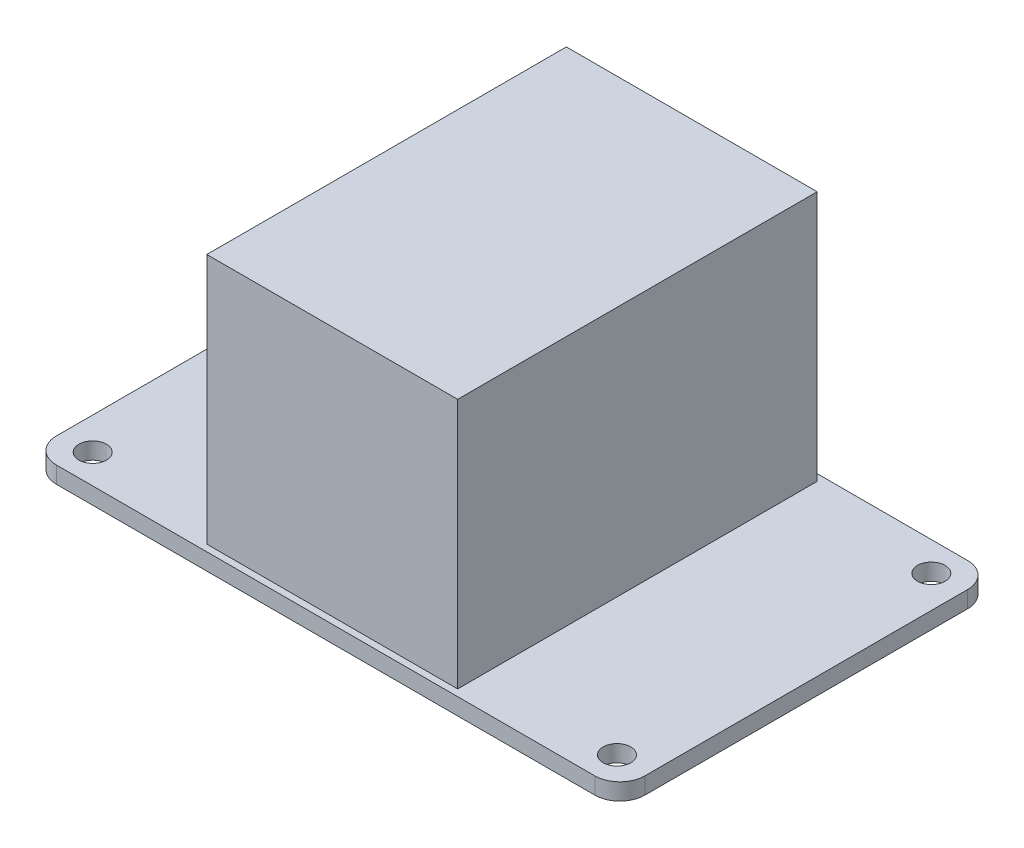
from build123d import *

# Parameters (mm, degrees)
SKETCH1_W           = 70.4
SKETCH1_H           = 44.6
BOSS_EXTRUDE1_DEPTH = 2
SKETCH3_R           = 1.65
CUT_EXTRUDE1_DEPTH  = 42.717262614
FILLET1_R           = 3
SKETCH4_W           = 30
SKETCH4_H           = 43
BOSS_EXTRUDE2_DEPTH = 30


with BuildPart() as part:
    # Sketch1 → Boss-Extrude1 (new body)
    with BuildSketch(Plane(origin=(0, 0, 0), x_dir=(1, 0, 0), z_dir=(0, 1, 0))):
        Rectangle(SKETCH1_W, SKETCH1_H)
    extrude(amount=BOSS_EXTRUDE1_DEPTH)

    # Sketch3 → Cut-Extrude1 (cut, through all)
    with BuildSketch(Plane(origin=(0, 2, 0), x_dir=(1, 0, 0), z_dir=(0, 1, 0))):
        with Locations(Location((-31.35, 18.8, 0), (0, 0, 270))):
            Circle(SKETCH3_R)
        with Locations(Location((31.35, 18.8, 0), (0, 0, 270))):
            Circle(SKETCH3_R)
        with Locations(Location((31.35, -18.8, 0), (0, 0, 270))):
            Circle(SKETCH3_R)
        with Locations(Location((-31.35, -18.8, 0), (0, 0, 270))):
            Circle(SKETCH3_R)
    extrude(amount=-CUT_EXTRUDE1_DEPTH, mode=Mode.SUBTRACT)

    # Fillet1
    fillet1_edges = [part.edges().sort_by_distance(p)[0] for p in [
        (35.2, 1, 22.3),
        (-35.2, 1, 22.3),
        (-35.2, 1, -22.3),
        (35.2, 1, -22.3),
    ]]
    fillet(fillet1_edges, radius=FILLET1_R)

    # Sketch4 → Boss-Extrude2 (add)
    with BuildSketch(Plane(origin=(0, 2, 0), x_dir=(1, 0, 0), z_dir=(0, 1, 0))):
        Rectangle(SKETCH4_W, SKETCH4_H)
    extrude(amount=BOSS_EXTRUDE2_DEPTH)


solid = part.part
